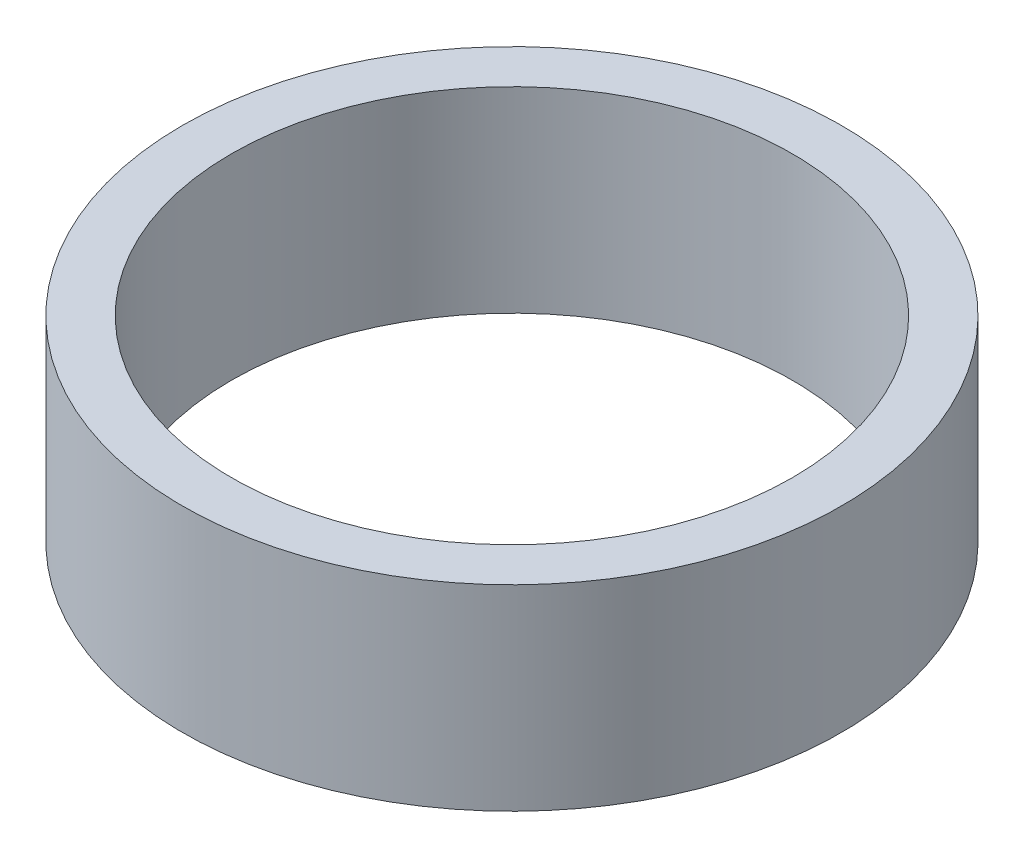
from build123d import *

# Parameters (mm, degrees)
SKETCH2_W = 6.35
SKETCH2_H = 25.4


with BuildPart() as part:
    # Sketch2 → Revolve1 (revolve)
    with BuildSketch(Plane.XY, mode=Mode.PRIVATE) as revolve1_sk:
        with Locations((39.497, 12.7)):
            Rectangle(SKETCH2_W, SKETCH2_H)
    revolve(revolve1_sk.sketch.rotate(Axis((0, 25.4, 0), (0, -1, 0)), 180), axis=Axis((0, 25.4, 0), (0, -1, 0)))


solid = part.part
